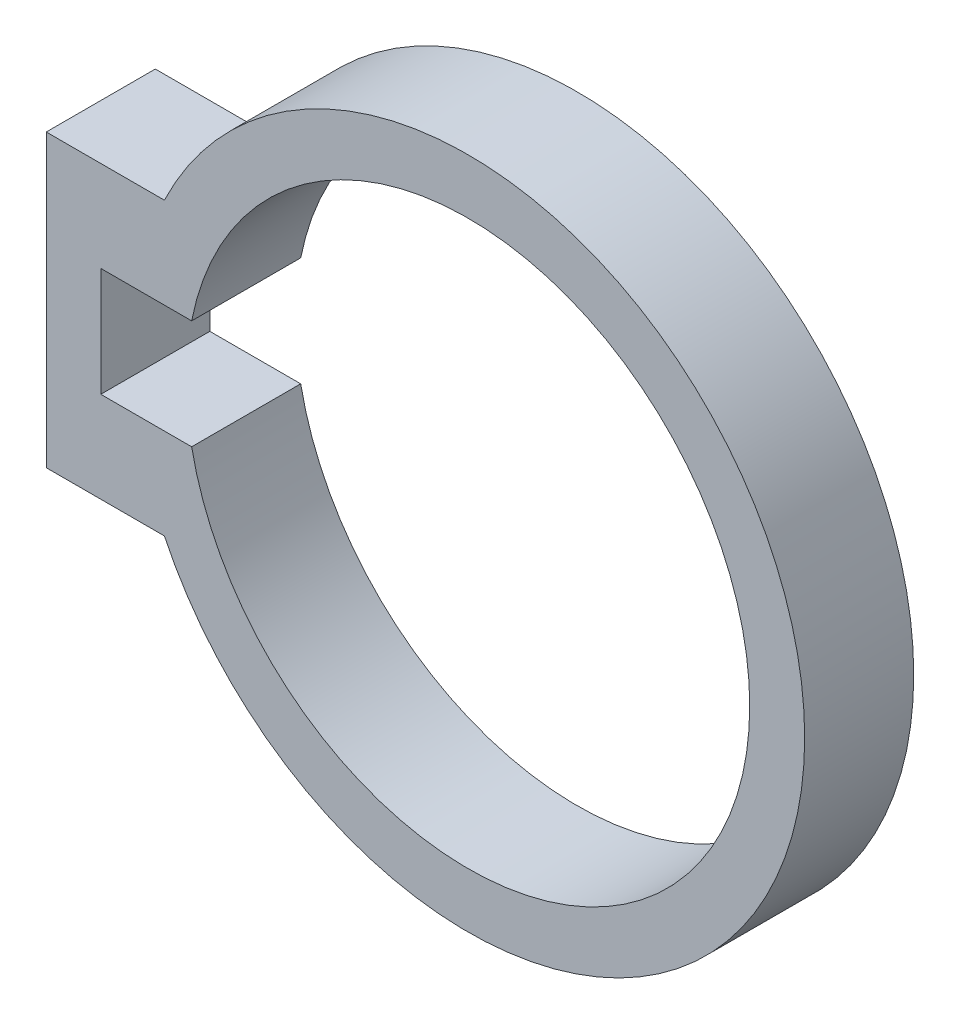
from build123d import *

# Parameters (mm, degrees)
BOSS_EXTRU_1_DEPTH = 6


with BuildPart() as part:
    # Esquisse1 → Boss.-Extru.1 (new body)
    with BuildSketch(Plane.XY):
        with BuildLine():
            Line((0, 0), (6.5, 0))
            ThreePointArc((6.5, 0), (41.730424323, -8), (6.5, -16))
            Line((6.5, -16), (0, -16))
            Line((0, -16), (0, 0))
        make_face()
        with BuildLine():
            Line((3, -5), (8, -5))
            ThreePointArc((8, -5), (38.706906326, -8), (8, -11))
            Line((8, -11), (3, -11))
            Line((3, -11), (3, -5))
        make_face(mode=Mode.SUBTRACT)
    extrude(amount=BOSS_EXTRU_1_DEPTH)


solid = part.part
